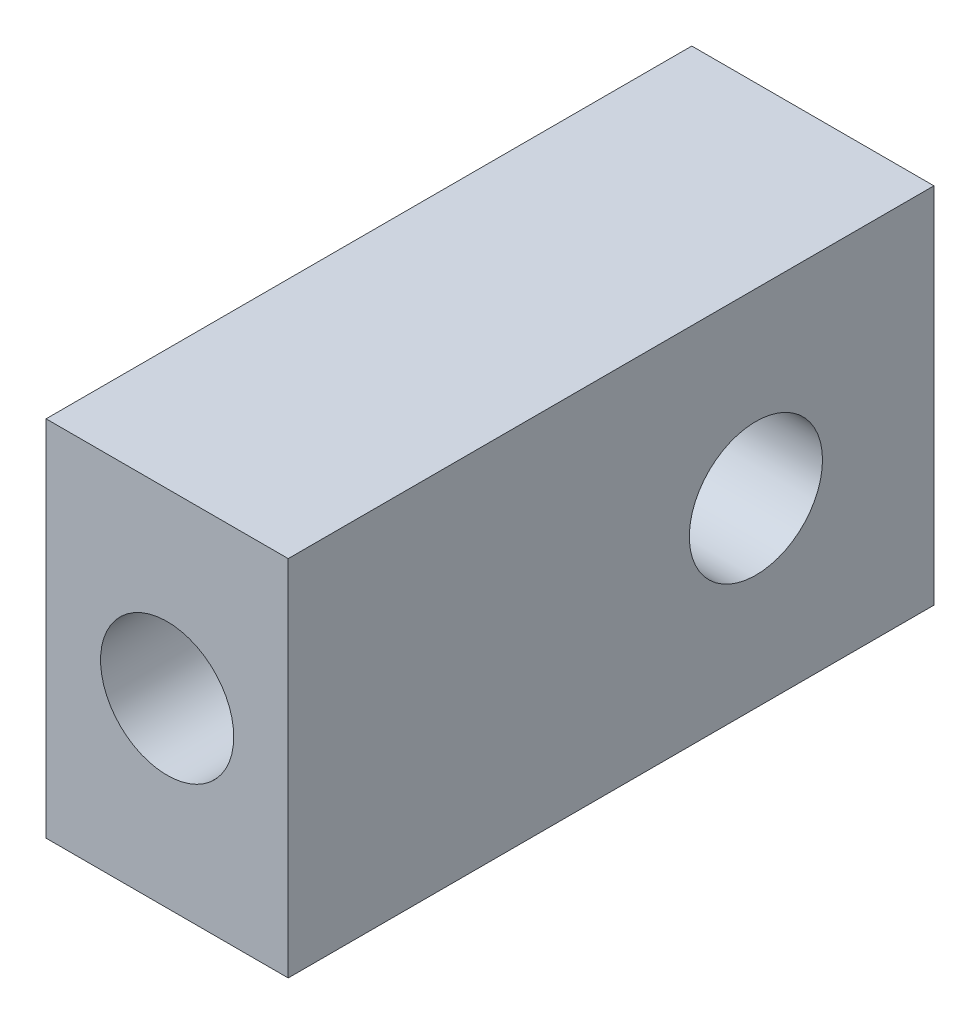
from build123d import *

# Parameters (mm, degrees)
SKETCH1_W             = 6
SKETCH1_H             = 9
BOSS_EXTRUDE1_DEPTH   = 16
M4_TAPPED_HOLE1_D     = 3.3
M4_TAPPED_HOLE1_DEPTH = 6
M4_TAPPED_HOLE1_TIP   = 0.991420021
M4_TAPPED_HOLE2_D     = 3.3


with BuildPart() as part:
    # Sketch1 → Boss-Extrude1 (new body)
    with BuildSketch(Plane.XY):
        Rectangle(SKETCH1_W, SKETCH1_H)
    extrude(amount=BOSS_EXTRUDE1_DEPTH)

    # M4 Tapped Hole1
    with Locations(Plane.XY.offset(16)):
        with Locations((0, 0)):
            Hole(M4_TAPPED_HOLE1_D / 2, depth=M4_TAPPED_HOLE1_DEPTH)
            with Locations((0, 0, -(M4_TAPPED_HOLE1_DEPTH + M4_TAPPED_HOLE1_TIP / 2))):  # 118° drill point
                Cone(0, M4_TAPPED_HOLE1_D / 2, M4_TAPPED_HOLE1_TIP, mode=Mode.SUBTRACT)

    # M4 Tapped Hole2 (through all)
    with Locations(Plane(origin=(3, 0, 0), x_dir=(0, 0, -1), z_dir=(1, 0, 0))):
        with Locations((-4.411118023, 0)):
            Hole(M4_TAPPED_HOLE2_D / 2)


solid = part.part
